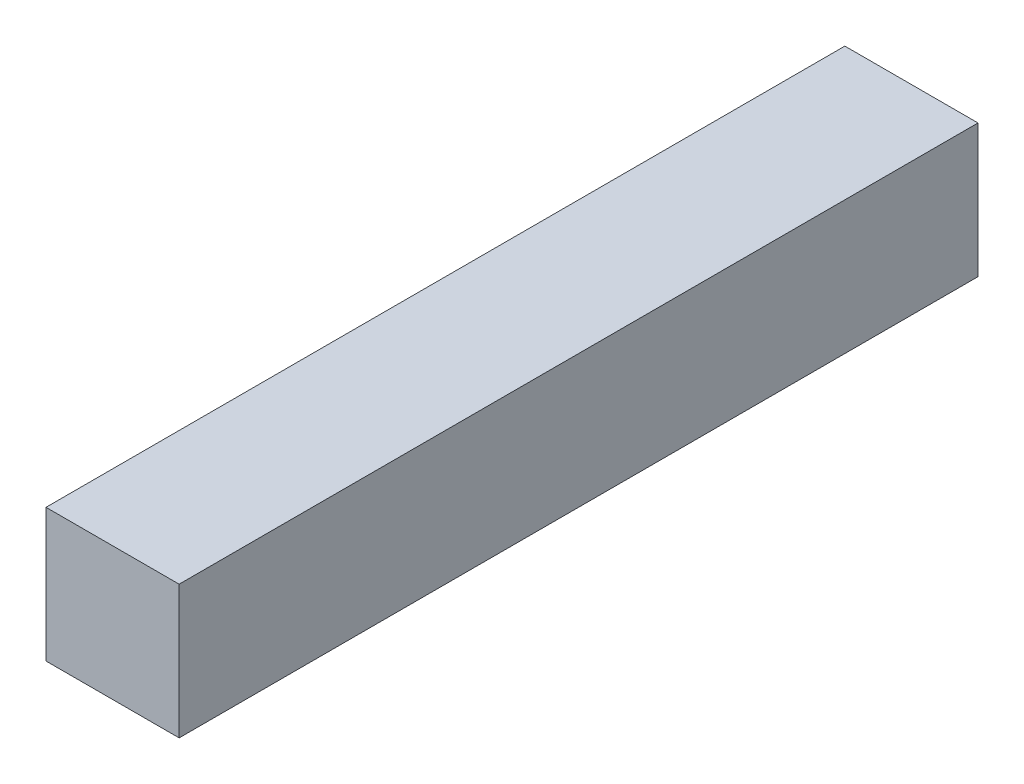
from build123d import *

# Parameters (mm, degrees)
SKETCH7_W           = 25.4
SKETCH7_H           = 25.4
BOSS_EXTRUDE3_DEPTH = 76.2


with BuildPart() as part:
    # Sketch7 → Boss-Extrude3 (new, symmetric)
    with BuildSketch(Plane.XY):
        Rectangle(SKETCH7_W, SKETCH7_H)
    extrude(amount=BOSS_EXTRUDE3_DEPTH, both=True)


solid = part.part
